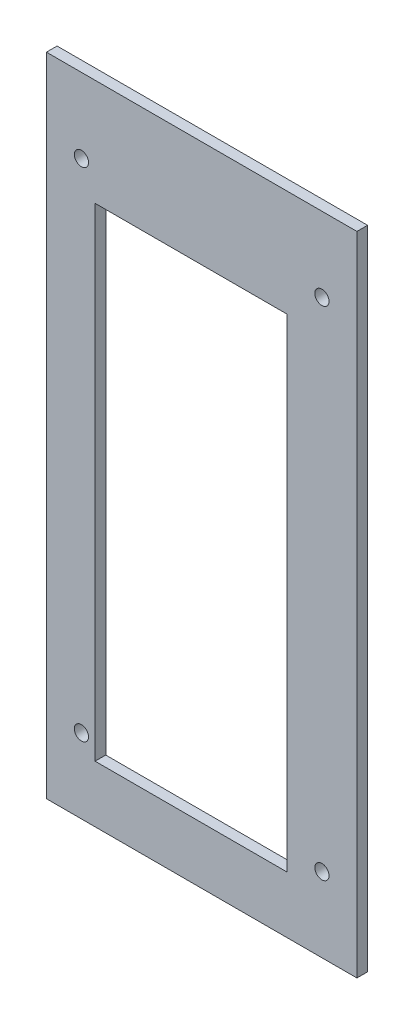
from build123d import *

# Parameters (mm, degrees)
SKETCH1_W           = 43.7
SKETCH1_H           = 91
SKETCH1_R           = 1
SKETCH1_W_2         = 27
SKETCH1_H_2         = 68
BOSS_EXTRUDE1_DEPTH = 1.5


with BuildPart() as part:
    # Sketch1 → Boss-Extrude1 (new body)
    with BuildSketch(Plane.XY):
        Rectangle(SKETCH1_W, SKETCH1_H)
        with Locations((16.925, 35)):
            Circle(SKETCH1_R, mode=Mode.SUBTRACT)
        with Locations((16.925, -35)):
            Circle(SKETCH1_R, mode=Mode.SUBTRACT)
        with Locations((-16.925, 35)):
            Circle(SKETCH1_R, mode=Mode.SUBTRACT)
        with Locations((-16.925, -35)):
            Circle(SKETCH1_R, mode=Mode.SUBTRACT)
        with Locations((-1.5, -3.5)):
            Rectangle(SKETCH1_W_2, SKETCH1_H_2, mode=Mode.SUBTRACT)
    extrude(amount=BOSS_EXTRUDE1_DEPTH)


solid = part.part
